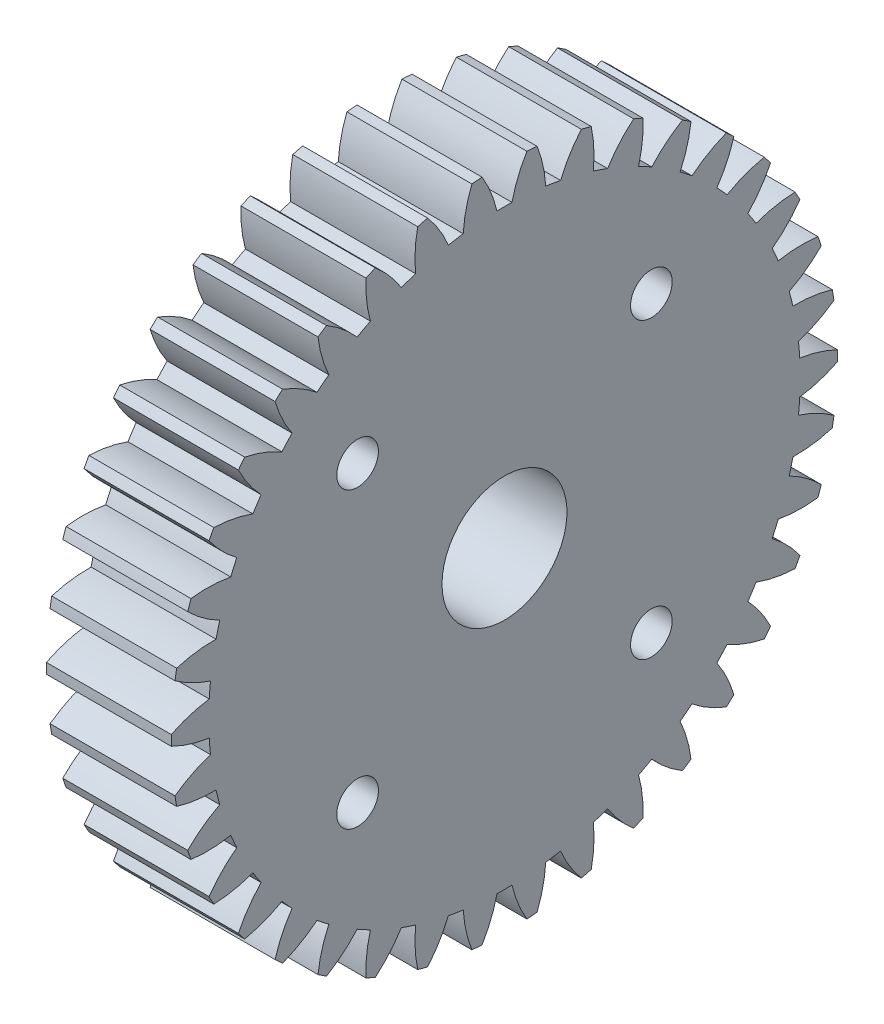
from build123d import *

# Parameters (mm, degrees)
BASPROSKE_W        = 6
BASPROSKE_H        = 16
TOOTHCUT_DEPTH     = 24.409399821
TEETHCUTS_COUNT    = 38
TEETHCUTS_ANGLE    = 350.526315789
BORSKE_R           = 3
BORE_DEPTH         = 50.0000508
SKETCH1_R          = 1
CUT_EXTRUDE1_DEPTH = 10


with BuildPart() as part:
    # BasProSke → Base-Revolve (revolve)
    with BuildSketch(Plane(origin=(0, 0, 0), x_dir=(1, 0, 0), z_dir=(0, 1, 0)), mode=Mode.PRIVATE) as base_revolve_sk:
        with Locations((3, 8)):
            Rectangle(BASPROSKE_W, BASPROSKE_H)
    revolve(base_revolve_sk.sketch.rotate(Axis((-10, 0, 0), (1, 0, 0)), 180), axis=Axis((-10, 0, 0), (1, 0, 0)))

    # TooCutSke → ToothCut (cut, through all)
    with BuildSketch(Plane(origin=(0, 0, 0), x_dir=(0, 0, -1), z_dir=(1, 0, 0))):
        with BuildLine():
            ThreePointArc((0.360517573, 14.194422429), (0, 14.199), (-0.360517573, 14.194422429))
            ThreePointArc((-0.360517573, 14.194422429), (-0.654064323, 15.120599675), (-1.091392894, 15.988192728))
            ThreePointArc((-1.091392894, 15.988192728), (0, 16.0254), (1.091392894, 15.988192728))
            ThreePointArc((1.091392894, 15.988192728), (0.654064323, 15.120599675), (0.360517573, 14.194422429))
        make_face()
    toothcut = extrude(amount=TOOTHCUT_DEPTH, mode=Mode.SUBTRACT)

    # TeethCuts: ToothCut ×38 about axis
    teethcuts_axis = Axis((-10, 0, 0), (1, 0, 0))
    for i in range(1, TEETHCUTS_COUNT):
        add(toothcut.rotate(teethcuts_axis, i * TEETHCUTS_ANGLE / (TEETHCUTS_COUNT - 1)), mode=Mode.SUBTRACT)

    # BorSke → Bore (cut, symmetric)
    with BuildSketch(Plane(origin=(0, 0, 0), x_dir=(0, 0, -1), z_dir=(1, 0, 0))):
        with Locations(Location((0, 0, 0), (0, 0, 180))):
            Circle(BORSKE_R)
    extrude(amount=BORE_DEPTH, both=True, mode=Mode.SUBTRACT)

    # Sketch1 → Cut-Extrude1 (cut)
    with BuildSketch(Plane(origin=(6, 0, 0), x_dir=(0, 0, -1), z_dir=(1, 0, 0))):
        with Locations((-7.05335, 7.05335)):
            Circle(SKETCH1_R)
        with Locations((7.05335, 7.05335)):
            Circle(SKETCH1_R)
        with Locations((7.05335, -7.05335)):
            Circle(SKETCH1_R)
        with Locations((-7.05335, -7.05335)):
            Circle(SKETCH1_R)
    extrude(amount=-CUT_EXTRUDE1_DEPTH, mode=Mode.SUBTRACT)


solid = part.part
